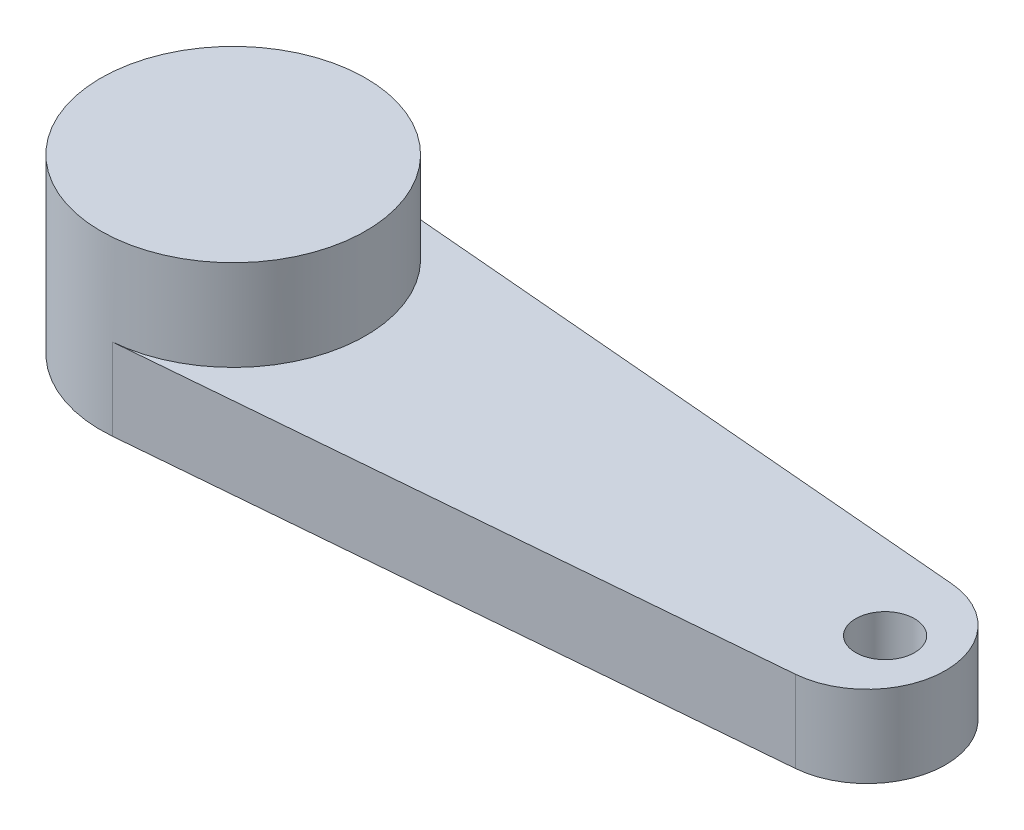
from build123d import *
from build123d.topology import SkipClean

# Parameters (mm, degrees)
SKETCH1_R           = 0.75
BOSS_EXTRUDE1_DEPTH = 2.08
SKETCH2_R           = 3.375
BOSS_EXTRUDE2_DEPTH = 2.31
SKETCH3_R           = 2.25
CUT_EXTRUDE1_DEPTH  = 0.84


with BuildPart() as part:
    # Sketch1 → Boss-Extrude1 (new body)
    with BuildSketch(Plane(origin=(0, 0, 0), x_dir=(1, 0, 0), z_dir=(0, 1, 0))):
        with BuildLine():
            Line((0.28743419, 3.36273796), (16.315331372, 1.992733606))
            ThreePointArc((16.315331372, 1.992733606), (18.145, 0), (16.315331372, -1.992733606))
            Line((16.315331372, -1.992733606), (0.28743419, -3.36273796))
            ThreePointArc((0.28743419, -3.36273796), (-3.375, 0), (0.28743419, 3.36273796))
        make_face()
        with Locations(Location((16.605, 0, 0), (0, 0, 270))):
            Circle(SKETCH1_R, mode=Mode.SUBTRACT)
    extrude(amount=BOSS_EXTRUDE1_DEPTH)

    # Sketch2 → Boss-Extrude2 (add)
    with SkipClean():  # the faces are left unmerged after this step: merging them gives an invalid solid
        with BuildSketch(Plane(origin=(0, 2.08, 0), x_dir=(1, 0, 0), z_dir=(0, 1, 0))):
            with Locations(Location((0, 0, 0), (0, 0, 85.114447475))):
                Circle(SKETCH2_R)
        extrude(amount=BOSS_EXTRUDE2_DEPTH)

    # Sketch3 → Cut-Extrude1 (cut)
    with SkipClean():  # the faces are left unmerged after this step: merging them gives an invalid solid
        with BuildSketch(Plane(origin=(0, 0, 0), x_dir=(1, 0, 0), z_dir=(0, 1, 0))):
            with Locations(Location((0, 0, 0), (0, 0, 270))):
                Circle(SKETCH3_R)
        extrude(amount=CUT_EXTRUDE1_DEPTH, mode=Mode.SUBTRACT)


solid = part.part
